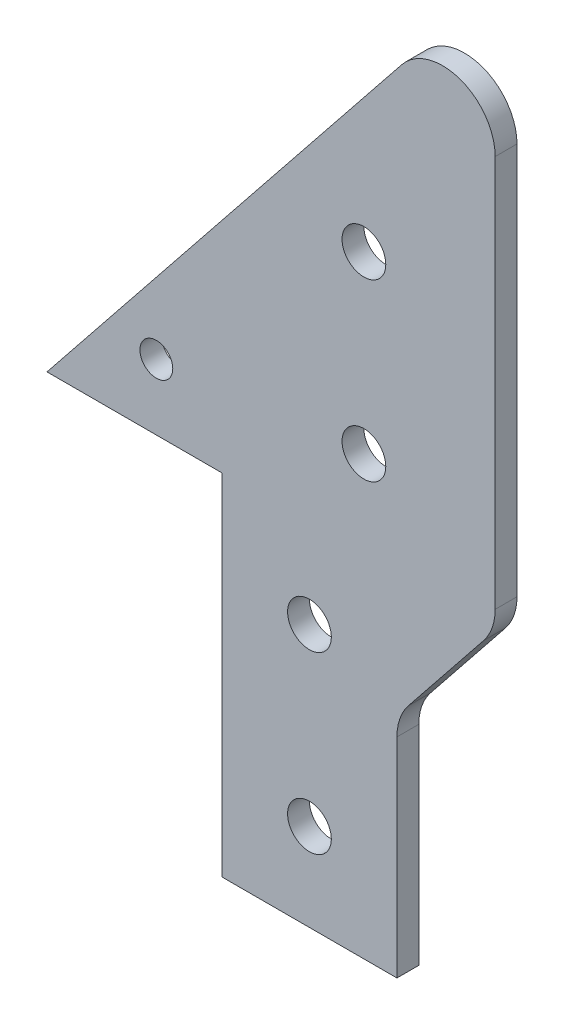
from build123d import *

# Parameters (mm, degrees)
SKETCH1_R           = 2.38125
SKETCH1_R_2         = 3.175
BOSS_EXTRUDE1_DEPTH = 3.175
FILLET1_R           = 7.62


with BuildPart() as part:
    # Sketch1 → Boss-Extrude1 (new body)
    with BuildSketch(Plane.XY):
        Polygon((0, 0), (25.4, 0), (25.4, -50.8), (50.8, -50.8), (50.8, -17.819677815), (65.055742252, 0), (65.055742252, 81.319677815), align=None)
        with Locations((15.875, 9.525)):
            Circle(SKETCH1_R, mode=Mode.SUBTRACT)
        with Locations((46.005742252, 38.1)):
            Circle(SKETCH1_R_2, mode=Mode.SUBTRACT)
        with Locations((46.005742252, 12.7)):
            Circle(SKETCH1_R_2, mode=Mode.SUBTRACT)
        with Locations((38.1, -12.7)):
            Circle(SKETCH1_R_2, mode=Mode.SUBTRACT)
        with Locations((38.1, -38.1)):
            Circle(SKETCH1_R_2, mode=Mode.SUBTRACT)
    extrude(amount=BOSS_EXTRUDE1_DEPTH)

    # Fillet1
    fillet1_edges = [part.edges().sort_by_distance(p)[0] for p in [
        (65.055742252, 81.319677815, 1.5875),
        (65.055742252, 0, 1.5875),
        (50.8, -17.819677815, 1.5875),
    ]]
    fillet(fillet1_edges, radius=FILLET1_R)


solid = part.part
